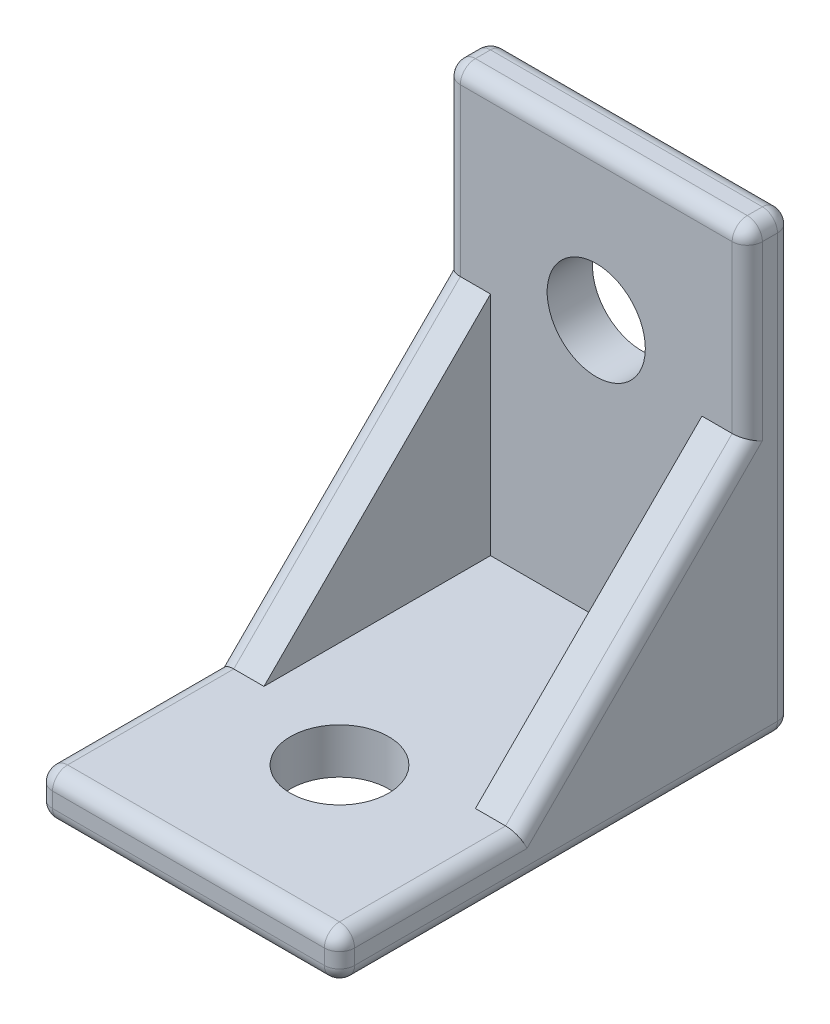
from build123d import *

# Parameters (mm, degrees)
SKETCH1_W           = 20
SKETCH1_H           = 30
SKETCH1_R           = 3.25
BOSS_EXTRUDE1_DEPTH = 3
SKETCH2_W           = 20
SKETCH2_H           = 3
BOSS_EXTRUDE2_DEPTH = 27
SKETCH3_R           = 3.25
CUT_EXTRUDE1_DEPTH  = 46.044422518
BOSS_EXTRUDE3_DEPTH = 3
FILLET1_R           = 1


with BuildPart() as part:
    # Sketch1 → Boss-Extrude1 (new body)
    with BuildSketch(Plane(origin=(0, 0, 0), x_dir=(1, 0, 0), z_dir=(0, 1, 0))):
        with Locations((-10, 15)):
            Rectangle(SKETCH1_W, SKETCH1_H)
        with Locations(Location((-10, 10, 0), (0, 0, 270))):
            Circle(SKETCH1_R, mode=Mode.SUBTRACT)
    extrude(amount=BOSS_EXTRUDE1_DEPTH)

    # Sketch2 → Boss-Extrude2 (add)
    with BuildSketch(Plane(origin=(0, 3, 0), x_dir=(1, 0, 0), z_dir=(0, 1, 0))):
        with Locations((-10, 28.5)):
            Rectangle(SKETCH2_W, SKETCH2_H)
    extrude(amount=BOSS_EXTRUDE2_DEPTH)

    # Sketch3 → Cut-Extrude1 (cut, through all)
    with BuildSketch(Plane.XY.offset(-27)):
        with Locations((-10, 20)):
            Circle(SKETCH3_R)
    extrude(amount=-CUT_EXTRUDE1_DEPTH, mode=Mode.SUBTRACT)

    # Sketch5 → Boss-Extrude3 (add)
    with BuildSketch(Plane(origin=(0, 0, 0), x_dir=(0, 0, -1), z_dir=(1, 0, 0))):
        Polygon((12, 3), (27, 18), (27, 3), align=None)
    boss_extrude3 = extrude(amount=-BOSS_EXTRUDE3_DEPTH)

    # Mirror1: Boss-Extrude3 across plane
    add(boss_extrude3.mirror(Plane.ZY.offset(10)))

    # Fillet1
    fillet1_edges = [part.edges().sort_by_distance(p)[0] for p in [
        (-10, 3, 0),
        (-20, 24, -27),
        (0, 24, -27),
        (-20, 30, -28.5),
        (-10, 30, -27),
        (0, 30, -28.5),
        (-10, 30, -30),
        (0, 10.5, -19.5),
        (-20, 3, -6),
        (-20, 10.5, -19.5),
        (0, 3, -6),
        (-10, 0, 0),
        (-20, 0, -15),
        (-10, 0, -30),
        (0, 0, -15),
        (0, 1.5, 0),
        (-20, 1.5, 0),
        (-20, 15, -30),
        (0, 15, -30),
    ]]
    fillet(fillet1_edges, radius=FILLET1_R)


solid = part.part
